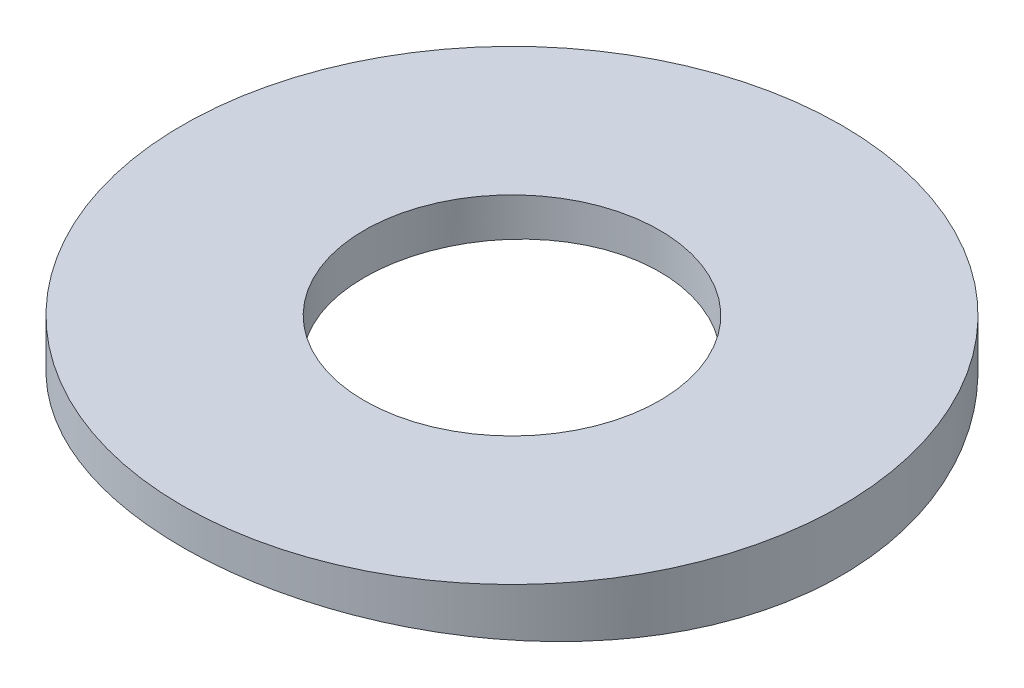
from build123d import *

# Parameters (mm, degrees)
SKETCH2_R               = 4.575
BOSS_EXTRUDE1_DEPTH     = 31.5
CUT_EXTRUDE1_DEPTH      = 33.15760019
CUT_EXTRUDE1_DEPTH_BACK = 33.15760019
SKETCH1_R               = 31
CUT_EXTRUDE2_DEPTH      = 7.524256813
CUT_EXTRUDE2_DEPTH_BACK = 7.524256813
SKETCH3_R               = 2.05


with BuildPart() as part:
    # Sketch2 → Boss-Extrude1 (new body)
    with BuildSketch(Plane(origin=(0, 0, 0), x_dir=(-1, 0, 0), z_dir=(0, 1, 0))):
        with Locations(Location((0, 0, 0), (0, 0, 90))):
            Circle(SKETCH2_R)
    extrude(amount=BOSS_EXTRUDE1_DEPTH)

    # Sketch1 → Cut-Extrude1 (cut, two sides: drawn at the far end of the back side and taken through both)
    with BuildSketch(Plane(origin=(0, 0, 0), x_dir=(0, 1, 0), z_dir=(0, 0, 1)).offset(-CUT_EXTRUDE1_DEPTH_BACK)):
        Circle(SKETCH1_R)
    extrude(amount=CUT_EXTRUDE1_DEPTH + CUT_EXTRUDE1_DEPTH_BACK, mode=Mode.SUBTRACT)

    # Sketch3 → Cut-Extrude2 (cut, two sides: drawn at the far end of the back side and taken through both)
    with BuildSketch(Plane(origin=(0, 31.5, 0), x_dir=(-1, 0, 0), z_dir=(0, 1, 0)).offset(-CUT_EXTRUDE2_DEPTH_BACK)):
        with Locations(Location((0, 0, 0), (0, 0, 90))):
            Circle(SKETCH3_R)
    extrude(amount=CUT_EXTRUDE2_DEPTH + CUT_EXTRUDE2_DEPTH_BACK, mode=Mode.SUBTRACT)


solid = part.part
